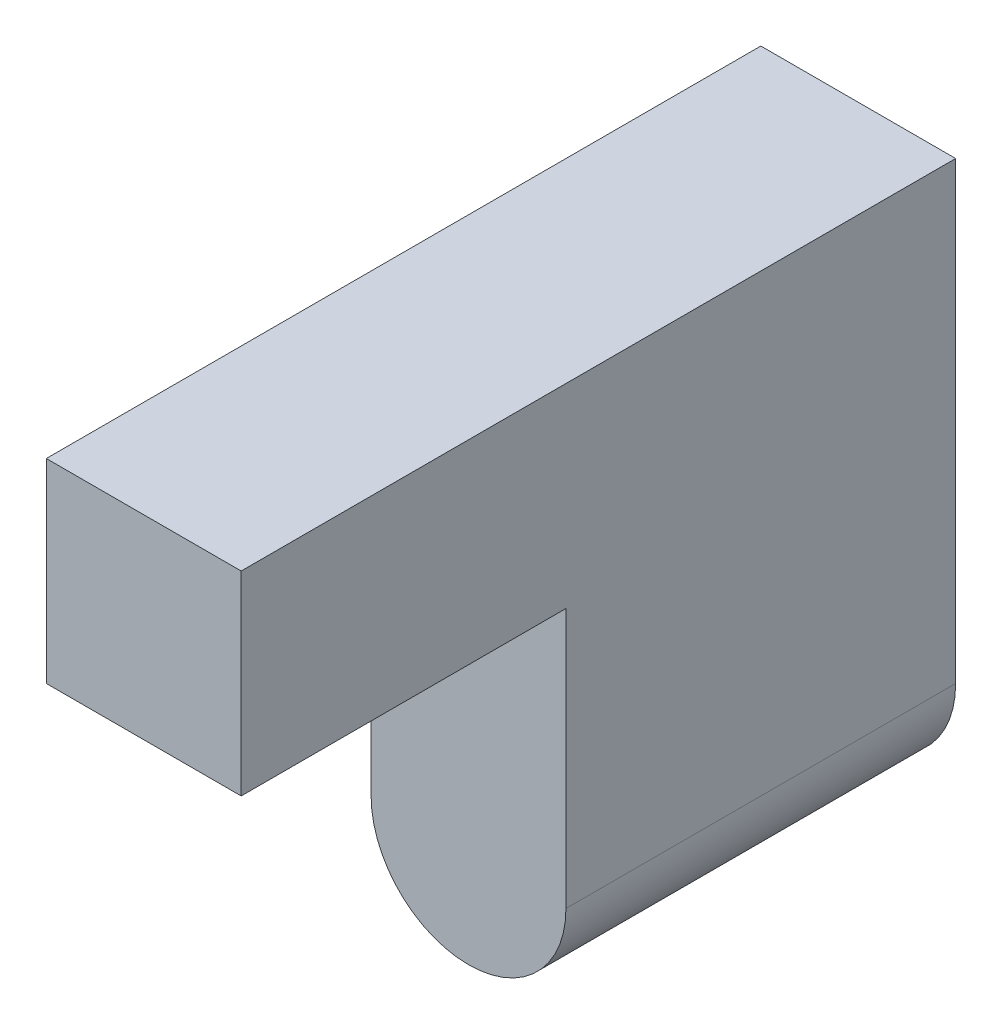
from build123d import *

# Parameters (mm, degrees)
BOSS_EXTRUDE1_DEPTH = 6
SKETCH1_3_W         = 3
SKETCH1_3_H         = 3
BOSS_EXTRUDE2_DEPTH = 11


with BuildPart() as part:
    # Sketch1 → Boss-Extrude1 (new body)
    with BuildSketch(Plane.XY):
        with BuildLine():
            Line((1.5, 0.5), (-1.5, 0.5))
            Line((-1.5, 0.5), (-1.5, -3.5))
            ThreePointArc((-1.5, -3.5), (0, -5), (1.5, -3.5))
            Line((1.5, -3.5), (1.5, 0.5))
        make_face()
    extrude(amount=BOSS_EXTRUDE1_DEPTH)

    # Sketch1<3> → Boss-Extrude2 (add)
    with BuildSketch(Plane.XY):
        with Locations((0, 2)):
            Rectangle(SKETCH1_3_W, SKETCH1_3_H)
    extrude(amount=BOSS_EXTRUDE2_DEPTH)


solid = part.part
